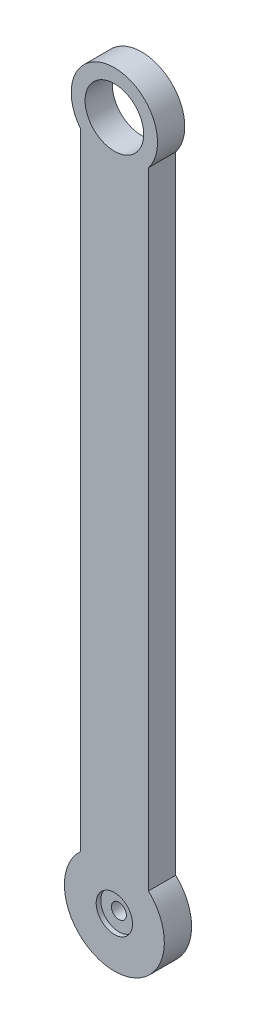
from build123d import *

# Parameters (mm, degrees)
ESQUISSE1_W             = 15
ESQUISSE1_H             = 165
BOSS_EXTRU_1_DEPTH      = 6
ESQUISSE2_R             = 11
ESQUISSE2_R_2           = 9.5
BOSS_EXTRU_2_DEPTH      = 6
ESQUISSE3_R             = 1.65
ESQUISSE3_R_2           = 6.45
ENL_V_MAT_EXTRU_1_DEPTH = 10
ESQUISSE4_R             = 4
ENL_V_MAT_EXTRU_2_DEPTH = 1


with BuildPart() as part:
    # Esquisse1 → Boss.-Extru.1 (new body)
    with BuildSketch(Plane.XY):
        with Locations((7.5, 82.5)):
            Rectangle(ESQUISSE1_W, ESQUISSE1_H)
    extrude(amount=BOSS_EXTRU_1_DEPTH)

    # Esquisse2 → Boss.-Extru.2 (add)
    with BuildSketch(Plane.XY.offset(6)):
        with Locations((7.5, 7.5)):
            Circle(ESQUISSE2_R)
        with Locations((7.5, 159.25)):
            Circle(ESQUISSE2_R_2)
    extrude(amount=-BOSS_EXTRU_2_DEPTH)

    # Esquisse3 → Enlèv. mat.-Extru.1 (cut)
    with BuildSketch(Plane(origin=(0, 0, 0), x_dir=(-1, 0, 0), z_dir=(0, 0, -1))):
        with Locations((-7.5, 7.5)):
            Circle(ESQUISSE3_R)
        with Locations((-7.5, 159.25)):
            Circle(ESQUISSE3_R_2)
    extrude(amount=-ENL_V_MAT_EXTRU_1_DEPTH, mode=Mode.SUBTRACT)

    # Esquisse4 → Enlèv. mat.-Extru.2 (cut)
    with BuildSketch(Plane.XY.offset(6)):
        with Locations((7.5, 7.5)):
            Circle(ESQUISSE4_R)
    extrude(amount=-ENL_V_MAT_EXTRU_2_DEPTH, mode=Mode.SUBTRACT)


solid = part.part
